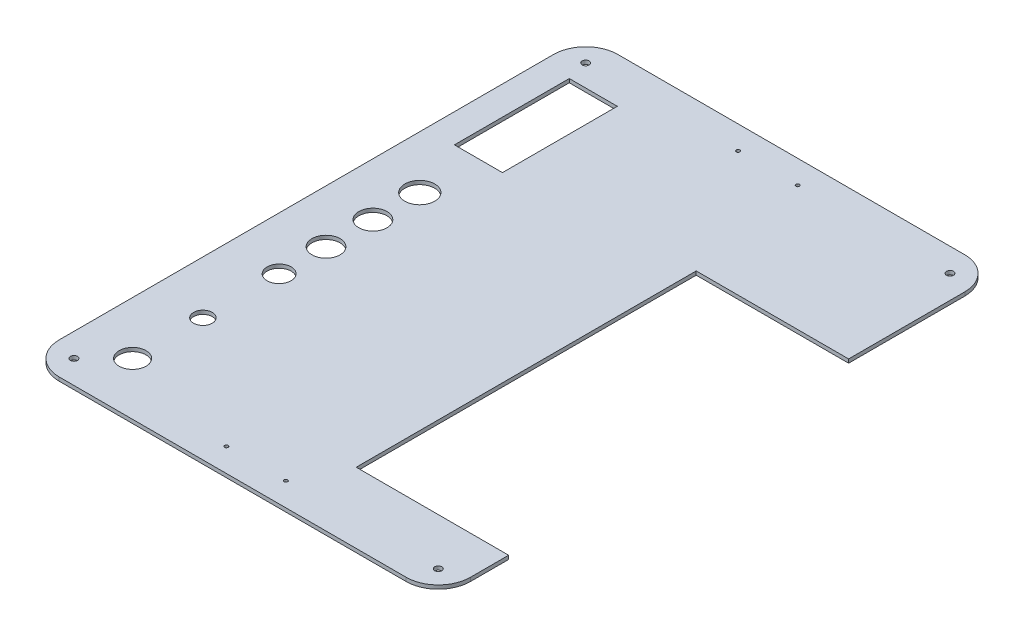
from build123d import *

# Parameters (mm, degrees)
BOSS_EXTRUDE1_DEPTH = 3.175
SKETCH2_W           = 130
SKETCH2_H           = 290
CUT_EXTRUDE1_DEPTH  = 10
SKETCH3_R           = 11.5
SKETCH3_R_2         = 8
SKETCH3_R_3         = 10.25
SKETCH3_R_4         = 12
SKETCH3_R_5         = 12.75
SKETCH3_R_6         = 3
SKETCH3_R_7         = 1.5
SKETCH3_W           = 41
SKETCH3_H           = 98
CUT_EXTRUDE2_DEPTH  = 296.862630114


with BuildPart() as part:
    # Sketch1 → Boss-Extrude1 (new body)
    with BuildSketch(Plane(origin=(0, 0, 0), x_dir=(1, 0, 0), z_dir=(0, 1, 0))):
        with BuildLine():
            Line((-147.955, 238.252), (147.955, 238.252))
            ThreePointArc((147.955, 238.252), (167.352353222, 230.217353222), (175.387, 210.82))
            Line((175.387, 210.82), (175.387, -210.82))
            ThreePointArc((175.387, -210.82), (167.352353222, -230.217353222), (147.955, -238.252))
            Line((147.955, -238.252), (-147.955, -238.252))
            ThreePointArc((-147.955, -238.252), (-167.352353222, -230.217353222), (-175.387, -210.82))
            Line((-175.387, -210.82), (-175.387, 210.82))
            ThreePointArc((-175.387, 210.82), (-167.352353222, 230.217353222), (-147.955, 238.252))
        make_face()
    extrude(amount=BOSS_EXTRUDE1_DEPTH)

    # Sketch2 → Cut-Extrude1 (cut)
    with BuildSketch(Plane(origin=(0, 3.175, 0), x_dir=(1, 0, 0), z_dir=(0, 1, 0))):
        with Locations((110.387, -33.252)):
            Rectangle(SKETCH2_W, SKETCH2_H)
    extrude(amount=-CUT_EXTRUDE1_DEPTH, mode=Mode.SUBTRACT)

    # Sketch3 → Cut-Extrude2 (cut, through all)
    with BuildSketch(Plane(origin=(0, 3.175, 0), x_dir=(1, 0, 0), z_dir=(0, 1, 0))):
        with Locations(Location((-130.387, -193.252, 0), (0, 0, 270))):
            Circle(SKETCH3_R)
        with Locations(Location((-130.387, -133.252, 0), (0, 0, 270))):
            Circle(SKETCH3_R_2)
        with Locations(Location((-130.387, -68.252, 0), (0, 0, 270))):
            Circle(SKETCH3_R_3)
        with Locations(Location((-130.387, -28.252, 0), (0, 0, 270))):
            Circle(SKETCH3_R_4)
        with Locations(Location((-130.387, 11.748, 0), (0, 0, 270))):
            Circle(SKETCH3_R_4)
        with Locations(Location((-130.387, 51.748, 0), (0, 0, 270))):
            Circle(SKETCH3_R_5)
        with Locations(Location((155.387, 218.252, 0), (0, 0, 270))):
            Circle(SKETCH3_R_6)
        with Locations(Location((155.387, -218.252, 0), (0, 0, 270))):
            Circle(SKETCH3_R_6)
        with Locations(Location((-155.387, -218.252, 0), (0, 0, 270))):
            Circle(SKETCH3_R_6)
        with Locations(Location((-155.387, 218.252, 0), (0, 0, 270))):
            Circle(SKETCH3_R_6)
        with Locations(Location((-25.4, 218.252, 0), (0, 0, 270))):
            Circle(SKETCH3_R_7)
        with Locations(Location((25.4, 218.252, 0), (0, 0, 270))):
            Circle(SKETCH3_R_7)
        with Locations(Location((-25.4, -218.252, 0), (0, 0, 270))):
            Circle(SKETCH3_R_7)
        with Locations(Location((25.4, -218.252, 0), (0, 0, 270))):
            Circle(SKETCH3_R_7)
        with Locations((-130.387, 150.748)):
            Rectangle(SKETCH3_W, SKETCH3_H)
    extrude(amount=-CUT_EXTRUDE2_DEPTH, mode=Mode.SUBTRACT)


solid = part.part
